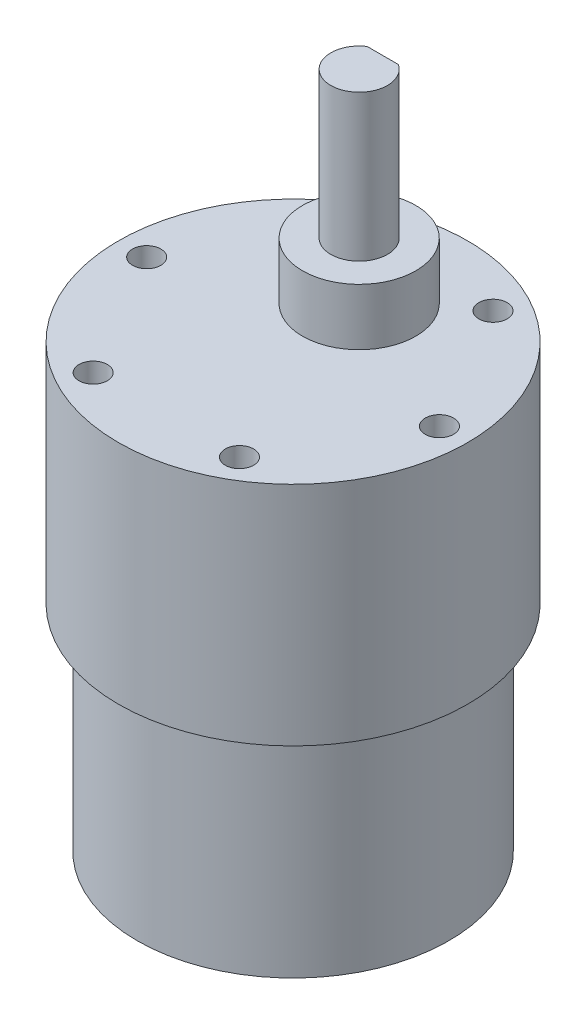
from build123d import *

# Parameters (mm, degrees)
SKETCH_1_R          = 16.5
EXTRUDE_1_DEPTH     = 22.7
SKETCH_2_R          = 18.5
EXTRUDE_2_DEPTH     = 24
SKETCH_3_R          = 6
EXTRUDE_3_DEPTH     = 6
SKETCH_4_R          = 3
EXTRUDE_4_DEPTH     = 15.5
CUT_EXTRUDE_1_DEPTH = 12
SKETCH_6_R          = 1.5
CUT_EXTRUDE_2_DEPTH = 10
SKETCH_7_R          = 5
EXTRUDE_5_DEPTH     = 2
FILLET_1_R          = 0.5


with BuildPart() as part:
    # 草图1 → 凸台-拉伸1 (new body)
    with BuildSketch(Plane(origin=(0, 0, 0), x_dir=(1, 0, 0), z_dir=(0, 1, 0))):
        with Locations(Location((0, 0, 0), (0, 0, 270))):
            Circle(SKETCH_1_R)
    extrude(amount=EXTRUDE_1_DEPTH)

    # 草图2 → 凸台-拉伸2 (add)
    with BuildSketch(Plane(origin=(0, 22.7, 0), x_dir=(1, 0, 0), z_dir=(0, 1, 0))):
        with Locations(Location((0, 0, 0), (0, 0, 270))):
            Circle(SKETCH_2_R)
    extrude(amount=EXTRUDE_2_DEPTH)

    # 草图3 → 凸台-拉伸3 (add)
    with BuildSketch(Plane(origin=(0, 46.7, 0), x_dir=(1, 0, 0), z_dir=(0, 1, 0))):
        with Locations(Location((0, 7, 0), (0, 0, 270))):
            Circle(SKETCH_3_R)
    extrude(amount=EXTRUDE_3_DEPTH)

    # 草图4 → 凸台-拉伸4 (add)
    with BuildSketch(Plane(origin=(0, 52.7, 0), x_dir=(1, 0, 0), z_dir=(0, 1, 0))):
        with Locations(Location((0, 7, 0), (0, 0, 270))):
            Circle(SKETCH_4_R)
    extrude(amount=EXTRUDE_4_DEPTH)

    # 草图5 → 切除-拉伸1 (cut)
    with BuildSketch(Plane(origin=(0, 68.2, 0), x_dir=(1, 0, 0), z_dir=(0, 1, 0))):
        Polygon((-80.661429966, 9.5), (-1.658312395, 9.5), (1.658312395, 9.5), (80.661429966, 9.5), (80.661429966, 167.506235142), (-80.661429966, 167.506235142), align=None)
    extrude(amount=-CUT_EXTRUDE_1_DEPTH, mode=Mode.SUBTRACT)

    # 草图6 → 切除-拉伸2 (cut)
    with BuildSketch(Plane(origin=(0, 46.7, 0), x_dir=(1, 0, 0), z_dir=(0, 1, 0))):
        with Locations(Location((15.5, 0, 0), (0, 0, 270))):
            Circle(SKETCH_6_R)
        with Locations(Location((7.75, -13.423393759, 0), (0, 0, 270))):
            Circle(SKETCH_6_R)
        with Locations(Location((-7.75, -13.423393759, 0), (0, 0, 270))):
            Circle(SKETCH_6_R)
        with Locations(Location((-15.5, 0, 0), (0, 0, 270))):
            Circle(SKETCH_6_R)
        with Locations(Location((-7.75, 13.423393759, 0), (0, 0, 270))):
            Circle(SKETCH_6_R)
        with Locations(Location((7.75, 13.423393759, 0), (0, 0, 270))):
            Circle(SKETCH_6_R)
    extrude(amount=-CUT_EXTRUDE_2_DEPTH, mode=Mode.SUBTRACT)

    # 草图7 → 凸台-拉伸5 (add)
    with BuildSketch(Plane.XZ):
        with Locations(Location((0, 0, 0), (0, 0, 90))):
            Circle(SKETCH_7_R)
    extrude(amount=EXTRUDE_5_DEPTH)

    # 圆角1
    fillet_1_edges = [part.edges().sort_by_distance(p)[0] for p in [
        (0, -2, -5),
    ]]
    fillet(fillet_1_edges, radius=FILLET_1_R)


solid = part.part
